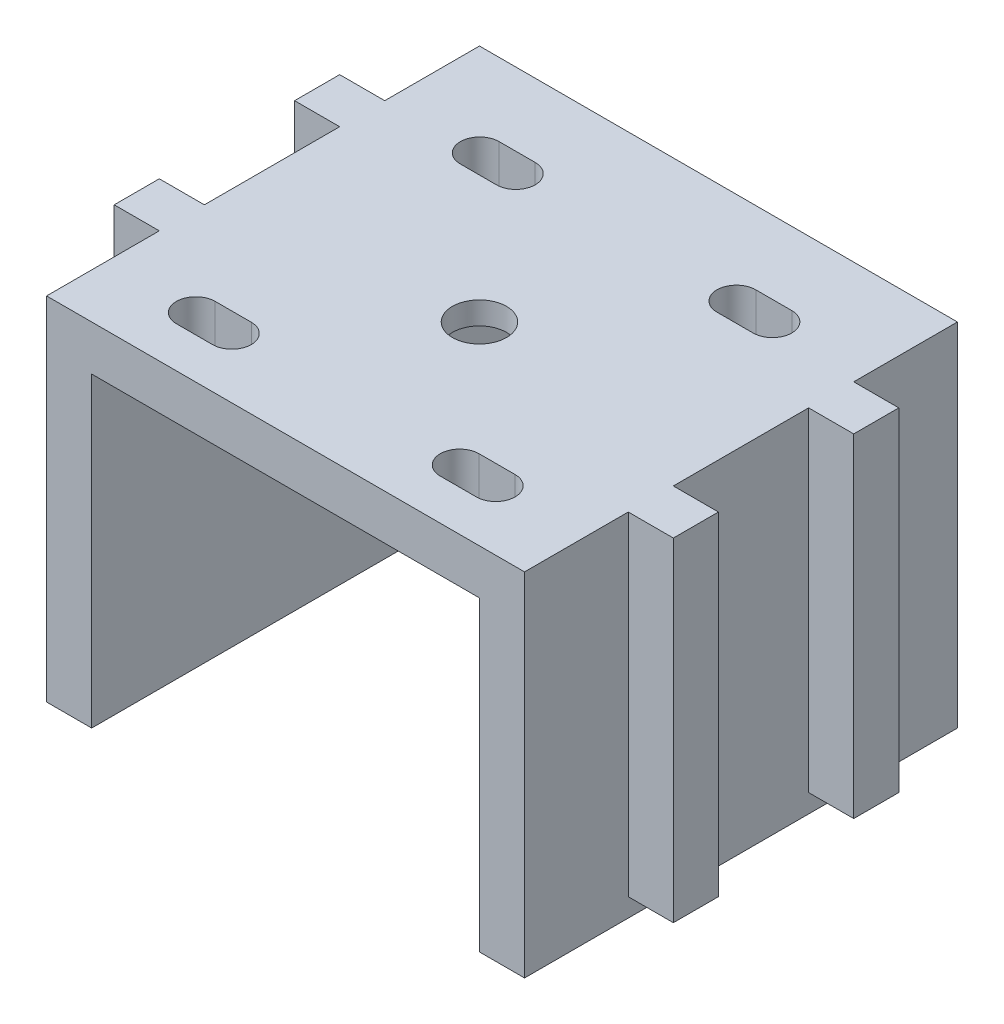
from build123d import *

# Parameters (mm, degrees)
BOSS_EXTRUDE4_DEPTH = 48
SKETCH2_W           = 43
SKETCH2_H           = 43
CUT_EXTRUDE2_DEPTH  = 43
SKETCH5_R           = 11.15
CUT_EXTRUDE3_DEPTH  = 2.5
SKETCH7_R           = 3
CUT_EXTRUDE4_DEPTH  = 2.5
CUT_EXTRUDE5_DEPTH  = 5
SKETCH9_W           = 36.942088093
SKETCH9_H           = 5
BOSS_EXTRUDE5_DEPTH = 5
SKETCH12_W          = 36.942088093
SKETCH12_H          = 5
BOSS_EXTRUDE6_DEPTH = 5


with BuildPart() as part:
    # Sketch1 → Boss-Extrude4 (new body)
    with BuildSketch(Plane(origin=(0, 0, 0), x_dir=(0, 1, 0), z_dir=(0, 0, 1))):
        Polygon((3.614394585, 8.871473005), (-15.885605415, 8.871473005), (-15.885605415, 13.871473005), (23.114394585, 13.871473005), (23.114394585, -39.128526995), (-15.885605415, -39.128526995), (-15.885605415, -34.128526995), (3.614394585, -34.128526995), align=None)
    extrude(amount=BOSS_EXTRUDE4_DEPTH)

    # Sketch2 → Cut-Extrude2 (cut)
    with BuildSketch(Plane.XY.offset(48)):
        with Locations((12.628526995, -3.385605415)):
            Rectangle(SKETCH2_W, SKETCH2_H)
    extrude(amount=-CUT_EXTRUDE2_DEPTH, mode=Mode.SUBTRACT)

    # Sketch5 → Cut-Extrude3 (cut)
    with BuildSketch(Plane.XZ.offset(-18.114394585)):
        with Locations(Location((12.628526995, 26.5, 0), (0, 0, 270))):
            Circle(SKETCH5_R)
    extrude(amount=-CUT_EXTRUDE3_DEPTH, mode=Mode.SUBTRACT)

    # Sketch7 → Cut-Extrude4 (cut)
    with BuildSketch(Plane.XZ.offset(-20.614394585)):
        with Locations(Location((12.628526995, 26.5, 0), (0, 0, 270))):
            Circle(SKETCH7_R)
    extrude(amount=-CUT_EXTRUDE4_DEPTH, mode=Mode.SUBTRACT)

    # Sketch8 → Cut-Extrude5 (cut)
    with BuildSketch(Plane.XZ.offset(-18.114394585)):
        with BuildLine():
            Line((-4, 43.474351547), (0, 43.474351547))
            ThreePointArc((0, 43.474351547), (2.15, 41.324351547), (0, 39.174351547))
            Line((0, 39.174351547), (-4, 39.174351547))
            ThreePointArc((-4, 39.174351547), (-6.15, 41.324351547), (-4, 43.474351547))
        make_face()
        with BuildLine():
            Line((28.856423603, 12.390432875), (24.856423603, 12.390432875))
            ThreePointArc((24.856423603, 12.390432875), (22.706423603, 10.240432875), (24.856423603, 8.090432875))
            Line((24.856423603, 8.090432875), (28.856423603, 8.090432875))
            ThreePointArc((28.856423603, 8.090432875), (31.006423603, 10.240432875), (28.856423603, 12.390432875))
        make_face()
        with BuildLine():
            Line((29.25705399, 43.474351547), (25.25705399, 43.474351547))
            ThreePointArc((25.25705399, 43.474351547), (23.10705399, 41.324351547), (25.25705399, 39.174351547))
            Line((25.25705399, 39.174351547), (29.25705399, 39.174351547))
            ThreePointArc((29.25705399, 39.174351547), (31.40705399, 41.324351547), (29.25705399, 43.474351547))
        make_face()
        with BuildLine():
            Line((-3.599369613, 12.390432875), (0.400630387, 12.390432875))
            ThreePointArc((0.400630387, 12.390432875), (2.550630387, 10.240432875), (0.400630387, 8.090432875))
            Line((0.400630387, 8.090432875), (-3.599369613, 8.090432875))
            ThreePointArc((-3.599369613, 8.090432875), (-5.749369613, 10.240432875), (-3.599369613, 12.390432875))
        make_face()
    extrude(amount=-CUT_EXTRUDE5_DEPTH, mode=Mode.SUBTRACT)

    # Sketch9 → Boss-Extrude5 (add)
    with BuildSketch(Plane(origin=(-13.871473005, 0, 0), x_dir=(0, -1, 0), z_dir=(-1, 0, 0))):
        with Locations((-4.643350539, 33)):
            Rectangle(SKETCH9_W, SKETCH9_H)
        with Locations((-4.643350539, 13)):
            Rectangle(SKETCH9_W, SKETCH9_H)
    extrude(amount=BOSS_EXTRUDE5_DEPTH)

    # Sketch12 → Boss-Extrude6 (add)
    with BuildSketch(Plane.YZ.offset(39.128526995)):
        with Locations((4.643350539, 34)):
            Rectangle(SKETCH12_W, SKETCH12_H)
        with Locations((4.643350539, 14)):
            Rectangle(SKETCH12_W, SKETCH12_H)
    extrude(amount=BOSS_EXTRUDE6_DEPTH)


solid = part.part
